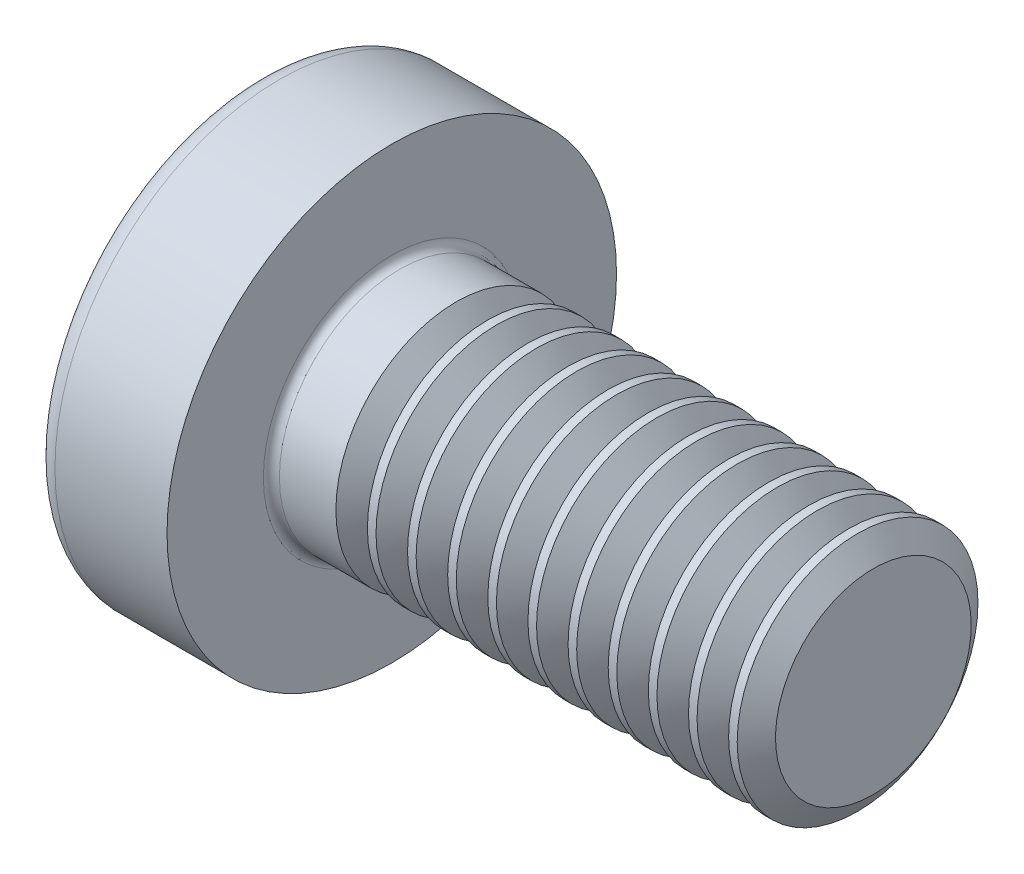
from build123d import *

# Parameters (mm, degrees)
FILLET1_R       = 0.1
RECPAT_COUNT    = 2
RECPAT_ANGLE    = 90
THDSCHPAT_COUNT = 11
THDSCHPAT_PITCH = 0.5


with BuildPart() as part:
    # BodySke → Base-Revolve (revolve)
    with BuildSketch(Plane.XY, mode=Mode.PRIVATE) as base_revolve_sk:
        with BuildLine():
            Line((2.4, 1.5), (2.4, 2.8))
            Line((2.4, 2.8), (1.003501533, 2.8))
            ThreePointArc((1.003501533, 2.8), (0.873295971, 2.76653015), (0.775371599, 2.674418605))
            ThreePointArc((0.775371599, 2.674418605), (0.197753546, 1.392274756), (0, 0))
            Line((0, 0), (8.4, 0))
            Line((8.4, 0), (8.4, 1.5))
            Line((8.4, 1.5), (2.4, 1.5))
        make_face()
    revolve(base_revolve_sk.sketch.rotate(Axis((1.003501533, 0, 0), (1, 0, 0)), 90), axis=Axis((1.003501533, 0, 0), (1, 0, 0)))

    # Fillet1
    fillet1_edges = [part.edges().sort_by_distance(p)[0] for p in [
        (2.4, 0, -1.5),
    ]]
    fillet(fillet1_edges, radius=FILLET1_R)

    # Sketch3 → Recess section 0
    with BuildSketch(Plane(origin=(0, 0, 0), x_dir=(0, 0, -1), z_dir=(1, 0, 0))):
        with BuildLine():
            Line((0.37, -1.4), (-0.37, -1.4))
            Line((-0.37, -1.4), (-0.37, 1.4))
            Line((-0.37, 1.4), (0.37, 1.4))
            Line((0.37, 1.4), (0.37, -1.4))
        make_face()
    # Sketch4 → Recess section 1
    with BuildSketch(Plane(origin=(1.75, 0, 0), x_dir=(0, 0, -1), z_dir=(1, 0, 0))):
        with BuildLine():
            Line((0.37, -0.527482216), (-0.37, -0.527482216))
            Line((-0.37, -0.527482216), (-0.37, 0.527482216))
            Line((-0.37, 0.527482216), (0.37, 0.527482216))
            Line((0.37, 0.527482216), (0.37, -0.527482216))
        make_face()
    recess = loft(mode=Mode.SUBTRACT)

    # RecPat: Recess ×2 about axis
    recpat_axis = Axis((0, 0, 0), (1, 0, 0))
    for i in range(1, RECPAT_COUNT):
        add(recess.rotate(recpat_axis, i * RECPAT_ANGLE / (RECPAT_COUNT - 1)), mode=Mode.SUBTRACT)

    # RecCorSke → RecessCore (revolve, cut)
    with BuildSketch(Plane.XY, mode=Mode.PRIVATE) as recesscore_sk:
        Polygon((0, 0), (0, 0.678371921), (1.75, 0.556), (1.930655351, 0), align=None)
    revolve(recesscore_sk.sketch.rotate(Axis((-3.175, 0, 0), (1, 0, 0)), 344.185974236), axis=Axis((-3.175, 0, 0), (1, 0, 0)), mode=Mode.SUBTRACT)

    # ThdSchSke → ThreadSchematic (revolve, cut)
    with BuildSketch(Plane.XY, mode=Mode.PRIVATE) as threadschematic_sk:
        Polygon((3.4, -1.2195), (3.203591786, -1.5), (3.203591786, -1.875), (3.596408214, -1.875), (3.596408214, -1.5), align=None)
    threadschematic = revolve(threadschematic_sk.sketch.rotate(Axis((-3.175, 0, 0), (1, 0, 0)), 270), axis=Axis((-3.175, 0, 0), (1, 0, 0)), mode=Mode.SUBTRACT)

    # ThdSchPat: ThreadSchematic ×11
    with Locations(*[(i * THDSCHPAT_PITCH, 0, 0) for i in range(1, THDSCHPAT_COUNT)]):
        add(threadschematic, mode=Mode.SUBTRACT)


solid = part.part
